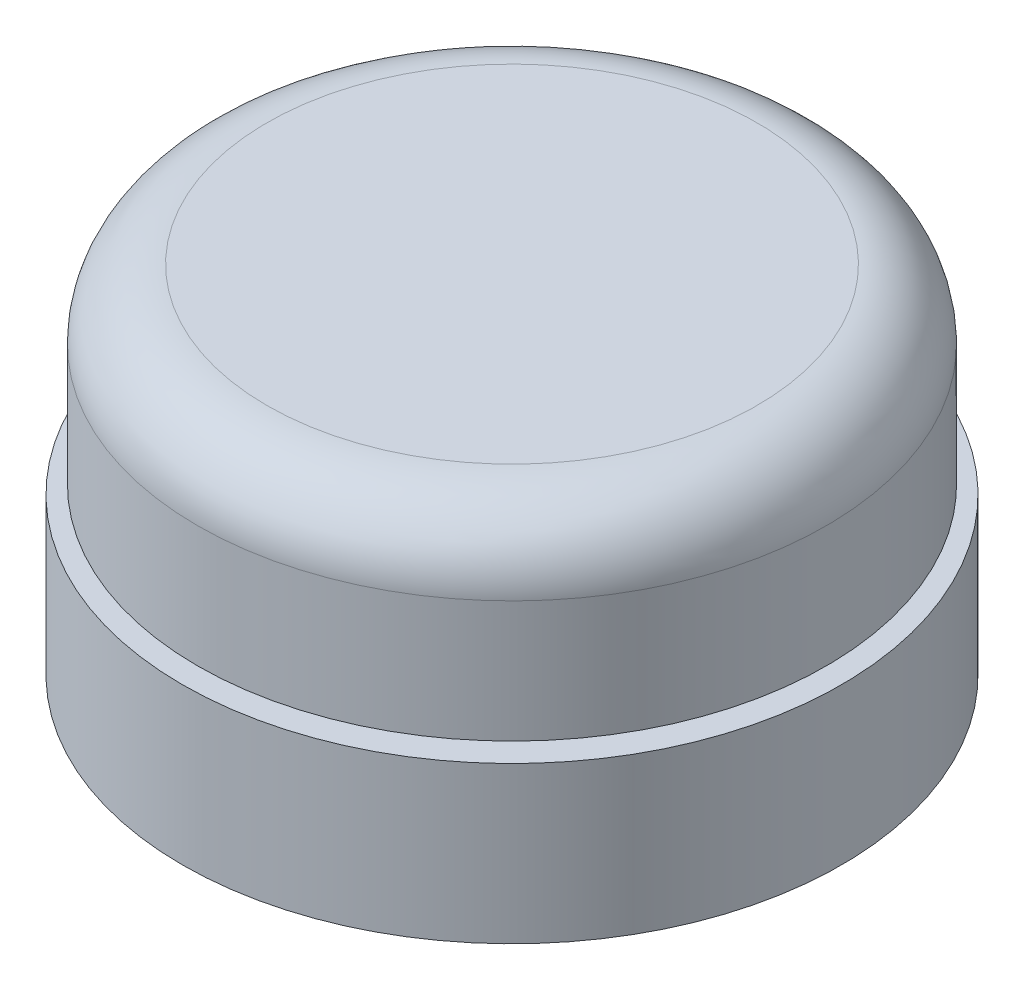
from build123d import *

# Parameters (mm, degrees)
SKETCH_1_R          = 38
EXTRUDE_1_DEPTH     = 18
SKETCH_2_R          = 28.672717561
EXTRUDE_2_DEPTH     = 1
SKETCH_3_R          = 36.25
EXTRUDE_3_DEPTH     = 22
FILLET_1_R          = 8
SKETCH_4_R          = 1.5
CUT_EXTRUDE_1_DEPTH = 5
CUT_EXTRUDE_START   = -20
SKETCH_5_W          = 48
SKETCH_5_H          = 10
CUT_EXTRUDE_2_DEPTH = 100


with BuildPart() as part:
    # 草图1 → 凸台-拉伸1 (new body)
    with BuildSketch(Plane(origin=(0, 0, 0), x_dir=(1, 0, 0), z_dir=(0, 1, 0))):
        with Locations(Location((0, 0, 0), (0, 0, 270))):
            Circle(SKETCH_1_R)
    extrude(amount=EXTRUDE_1_DEPTH)

    # 草图2 → 凸台-拉伸2 (add)
    with BuildSketch(Plane(origin=(0, 18, 0), x_dir=(1, 0, 0), z_dir=(0, 1, 0))):
        with Locations(Location((0, 0, 0), (0, 0, 270))):
            Circle(SKETCH_2_R)
    extrude(amount=EXTRUDE_2_DEPTH)

    # 草图3 → 凸台-拉伸3 (add)
    with BuildSketch(Plane(origin=(0, 19, 0), x_dir=(1, 0, 0), z_dir=(0, 1, 0))):
        with Locations(Location((0, 0, 0), (0, 0, 270))):
            Circle(SKETCH_3_R)
    extrude(amount=EXTRUDE_3_DEPTH)

    # 圆角1
    fillet_1_edges = [part.edges().sort_by_distance(p)[0] for p in [
        (0, 41, -36.25),
    ]]
    fillet(fillet_1_edges, radius=FILLET_1_R)

    # 草图4 → 切除-拉伸1 (cut)
    with BuildSketch(Plane.XZ):
        with Locations(Location((-29.5, 0, 0), (0, 0, 270))):
            Circle(SKETCH_4_R)
        with Locations(Location((-20.859650045, 20.859650045, 0), (0, 0, 270))):
            Circle(SKETCH_4_R)
        with Locations(Location((0, 29.5, 0), (0, 0, 270))):
            Circle(SKETCH_4_R)
        with Locations(Location((20.859650045, 20.859650045, 0), (0, 0, 270))):
            Circle(SKETCH_4_R)
        with Locations(Location((-34.5, 0, 0), (0, 0, 270))):
            Circle(SKETCH_4_R)
        with Locations(Location((29.5, 0, 0), (0, 0, 270))):
            Circle(SKETCH_4_R)
        with Locations(Location((20.859650045, -20.859650045, 0), (0, 0, 270))):
            Circle(SKETCH_4_R)
        with Locations(Location((0, -29.5, 0), (0, 0, 270))):
            Circle(SKETCH_4_R)
        with Locations(Location((-20.859650045, -20.859650045, 0), (0, 0, 270))):
            Circle(SKETCH_4_R)
    extrude(amount=-CUT_EXTRUDE_1_DEPTH, mode=Mode.SUBTRACT)

    # 草图5 → 切除-拉伸2 (cut)
    with BuildSketch(Plane(origin=(0, 0, 0), x_dir=(0, 0, -1), z_dir=(1, 0, 0)).offset(CUT_EXTRUDE_START)):
        with Locations((0, 26)):
            Rectangle(SKETCH_5_W, SKETCH_5_H)
    extrude(amount=-CUT_EXTRUDE_2_DEPTH, mode=Mode.SUBTRACT)


solid = part.part
